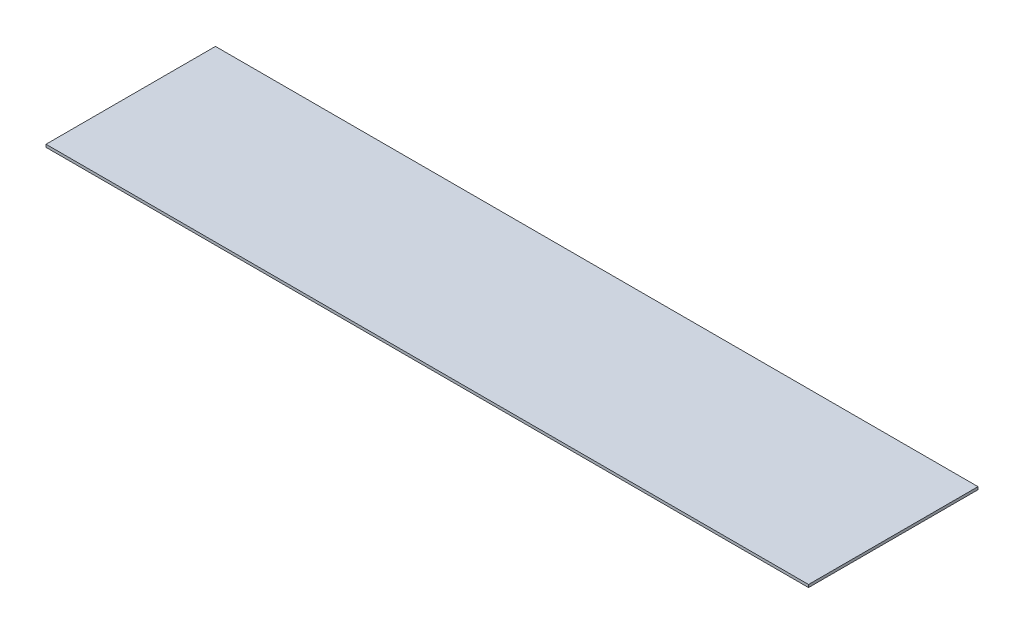
from build123d import *

# Parameters (mm, degrees)
SKETCH1_W           = 1787.525
SKETCH1_H           = 397.256
BOSS_EXTRUDE1_DEPTH = 6.35


with BuildPart() as part:
    # Sketch1 → Boss-Extrude1 (new body)
    with BuildSketch(Plane(origin=(0, 0, 0), x_dir=(1, 0, 0), z_dir=(0, 1, 0))):
        Rectangle(SKETCH1_W, SKETCH1_H)
    extrude(amount=BOSS_EXTRUDE1_DEPTH)


solid = part.part
